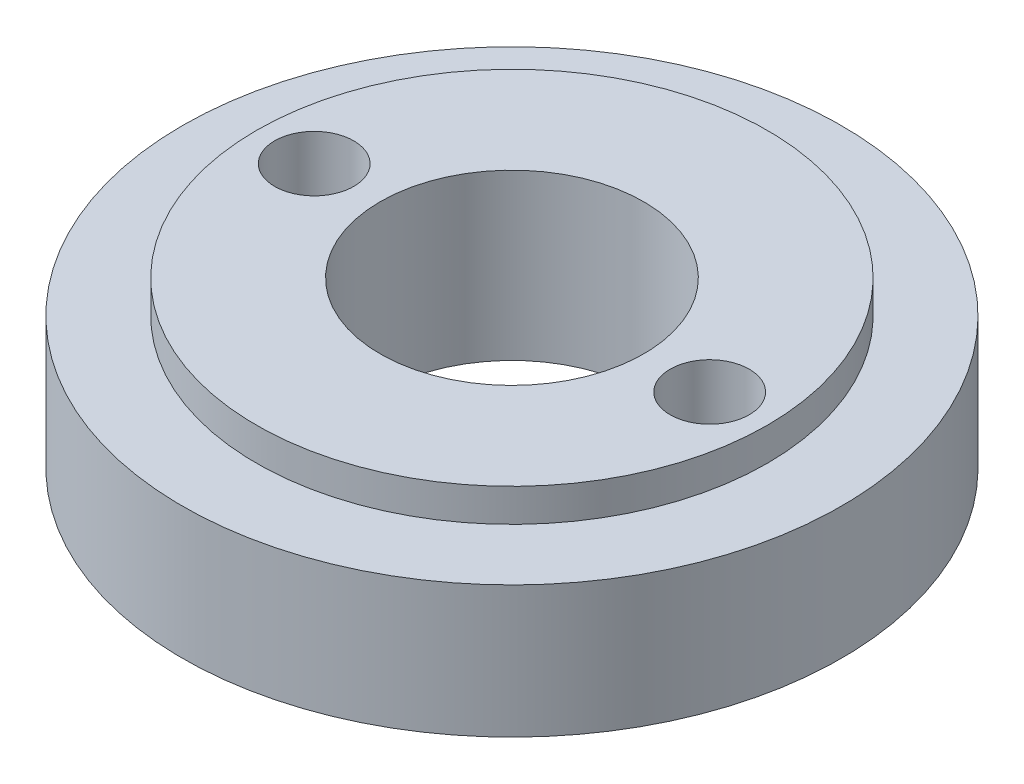
from build123d import *

# Parameters (mm, degrees)
ESQUISSE2_R             = 1.2
ENL_V_MAT_EXTRU_1_DEPTH = 16


with BuildPart() as part:
    # Esquisse1 → Révolution1 (revolve)
    with BuildSketch(Plane.XY, mode=Mode.PRIVATE) as r_volution1_sk:
        Polygon((4, 0), (4, -5), (10, -5), (10, -1), (7.75, -1), (7.75, 0), align=None)
    revolve(r_volution1_sk.sketch.rotate(Axis((0, 0, 0), (0, -1, 0)), 180), axis=Axis((0, 0, 0), (0, -1, 0)))

    # Esquisse2 → Enlèv. mat.-Extru.1 (cut, through all)
    with BuildSketch(Plane(origin=(0, 0, 0), x_dir=(1, 0, 0), z_dir=(0, 1, 0))):
        with Locations(Location((6, 0, 0), (0, 0, 180))):
            Circle(ESQUISSE2_R)
        with Locations(Location((-6, 0, 0), (0, 0, 180))):
            Circle(ESQUISSE2_R)
    extrude(amount=-ENL_V_MAT_EXTRU_1_DEPTH, mode=Mode.SUBTRACT)


solid = part.part
